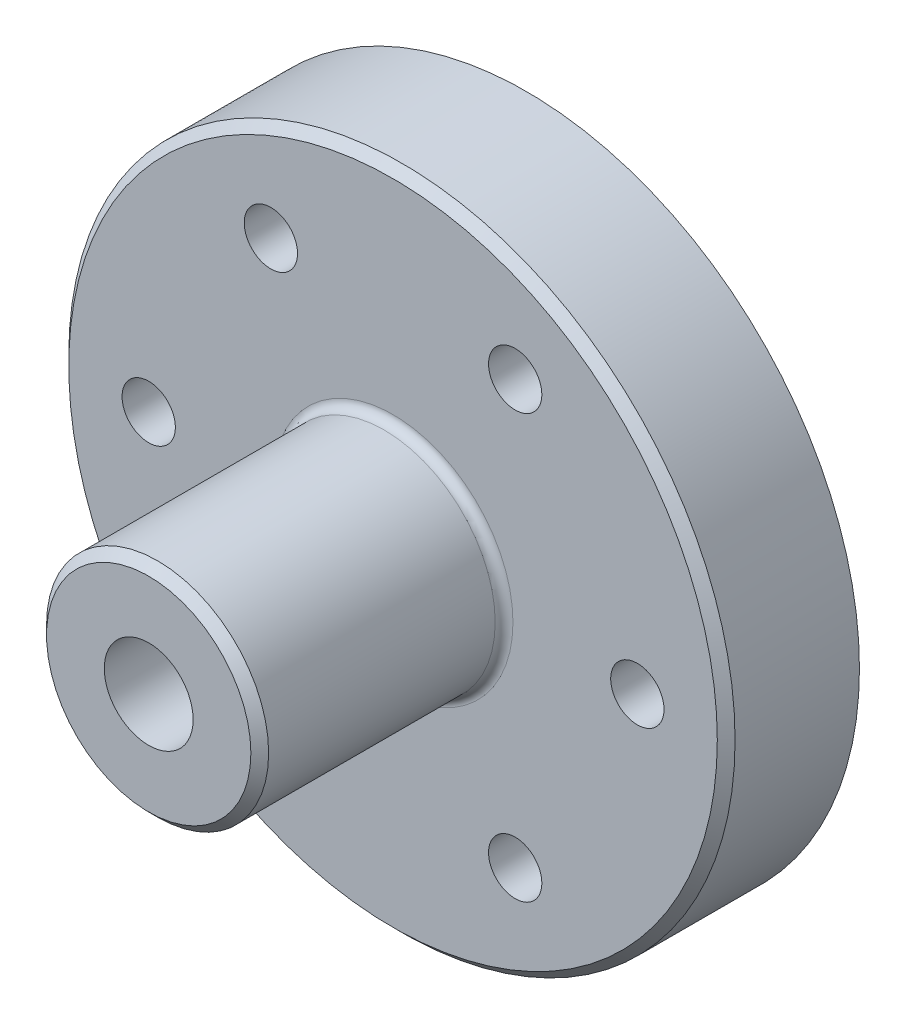
from build123d import *

# Parameters (mm, degrees)
SKETCH_1_R      = 75
SKETCH_1_R_2    = 6
EXTRUDE_1_DEPTH = 30
SKETCH_2_R      = 25
SKETCH_2_R_2    = 10
EXTRUDE_2_DEPTH = 55
CHAMFER_1_SIZE  = 2
FILLET_1_R      = 2


with BuildPart() as part:
    # 草图1 → 凸台-拉伸1 (new body)
    with BuildSketch(Plane.XY):
        Circle(SKETCH_1_R)
        with Locations((-55, 0)):
            Circle(SKETCH_1_R_2, mode=Mode.SUBTRACT)
        with Locations((-27.5, 47.631397208)):
            Circle(SKETCH_1_R_2, mode=Mode.SUBTRACT)
        with Locations((27.5, 47.631397208)):
            Circle(SKETCH_1_R_2, mode=Mode.SUBTRACT)
        with Locations((55, 0)):
            Circle(SKETCH_1_R_2, mode=Mode.SUBTRACT)
        with Locations((27.5, -47.631397208)):
            Circle(SKETCH_1_R_2, mode=Mode.SUBTRACT)
        with Locations((-27.5, -47.631397208)):
            Circle(SKETCH_1_R_2, mode=Mode.SUBTRACT)
    extrude(amount=EXTRUDE_1_DEPTH)

    # 草图2 → 凸台-拉伸2 (add)
    with BuildSketch(Plane.XY.offset(30)):
        Circle(SKETCH_2_R)
        Circle(SKETCH_2_R_2, mode=Mode.SUBTRACT)
    extrude(amount=EXTRUDE_2_DEPTH)

    # 倒角1
    chamfer_1_edges = [part.edges().sort_by_distance(p)[0] for p in [
        (-25, 0, 85),
        (-75, 0, 30),
    ]]
    chamfer(chamfer_1_edges, length=CHAMFER_1_SIZE)

    # 圆角1
    fillet_1_edges = [part.edges().sort_by_distance(p)[0] for p in [
        (-25, 0, 30),
    ]]
    fillet(fillet_1_edges, radius=FILLET_1_R)


solid = part.part
